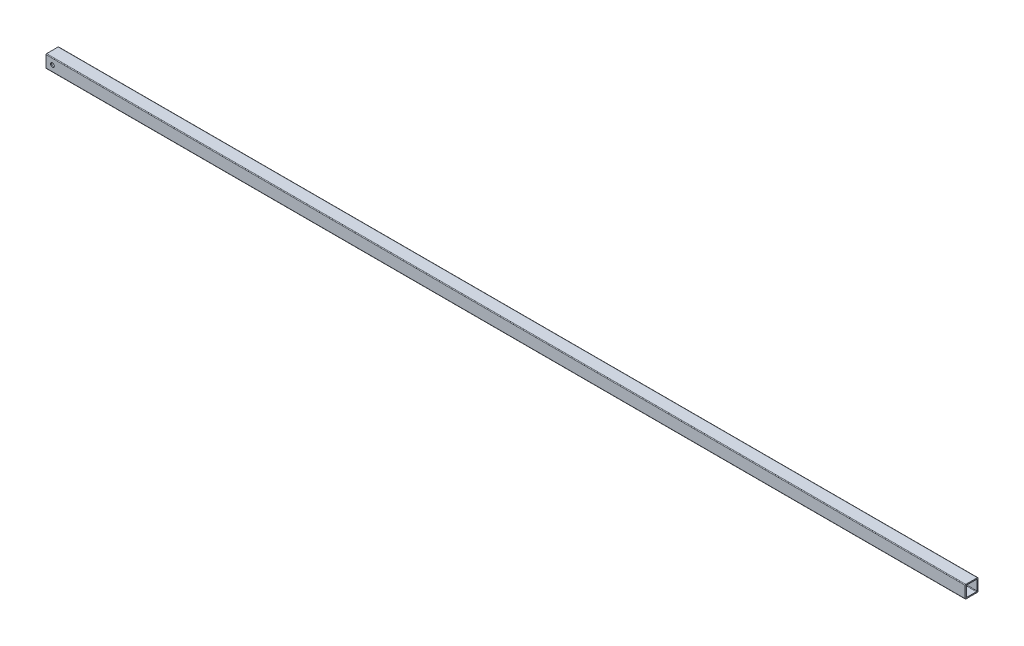
from build123d import *

# Parameters (mm, degrees)
BOSS_EXTRUDE1_DEPTH      = 914.4
BOSS_EXTRUDE1_DEPTH_BACK = 914.4
SKETCH5_R                = 3.81
CUT_EXTRUDE1_DEPTH       = 915.840865943


with BuildPart() as part:
    # Sketch4 → Boss-Extrude1 (new, two sides: drawn at the far end of the back side and taken through both)
    with BuildSketch(Plane(origin=(0, 0, 0), x_dir=(0, 0, -1), z_dir=(1, 0, 0)).offset(-BOSS_EXTRUDE1_DEPTH_BACK)):
        with BuildLine():
            Line((12.7, -11.43), (12.7, 11.43))
            ThreePointArc((12.7, 11.43), (12.328025612, 12.328025612), (11.43, 12.7))
            Line((11.43, 12.7), (-11.43, 12.7))
            ThreePointArc((-11.43, 12.7), (-12.328025612, 12.328025612), (-12.7, 11.43))
            Line((-12.7, 11.43), (-12.7, -11.43))
            ThreePointArc((-12.7, -11.43), (-12.328025612, -12.328025612), (-11.43, -12.7))
            Line((-11.43, -12.7), (11.43, -12.7))
            ThreePointArc((11.43, -12.7), (12.328025612, -12.328025612), (12.7, -11.43))
        make_face()
        with BuildLine():
            Line((10.5918, 9.53262), (10.5918, -9.53262))
            ThreePointArc((10.5918, -9.53262), (10.28157336, -10.28157336), (9.53262, -10.5918))
            Line((9.53262, -10.5918), (-9.53262, -10.5918))
            ThreePointArc((-9.53262, -10.5918), (-10.28157336, -10.28157336), (-10.5918, -9.53262))
            Line((-10.5918, -9.53262), (-10.5918, 9.53262))
            ThreePointArc((-10.5918, 9.53262), (-10.28157336, 10.28157336), (-9.53262, 10.5918))
            Line((-9.53262, 10.5918), (9.53262, 10.5918))
            ThreePointArc((9.53262, 10.5918), (10.28157336, 10.28157336), (10.5918, 9.53262))
        make_face(mode=Mode.SUBTRACT)
    extrude(amount=BOSS_EXTRUDE1_DEPTH + BOSS_EXTRUDE1_DEPTH_BACK)

    # Sketch5 → Cut-Extrude1 (cut, through all)
    with BuildSketch(Plane.XY.offset(12.7)):
        with Locations((-901.7, 0)):
            Circle(SKETCH5_R)
    extrude(amount=-CUT_EXTRUDE1_DEPTH, mode=Mode.SUBTRACT)


solid = part.part
